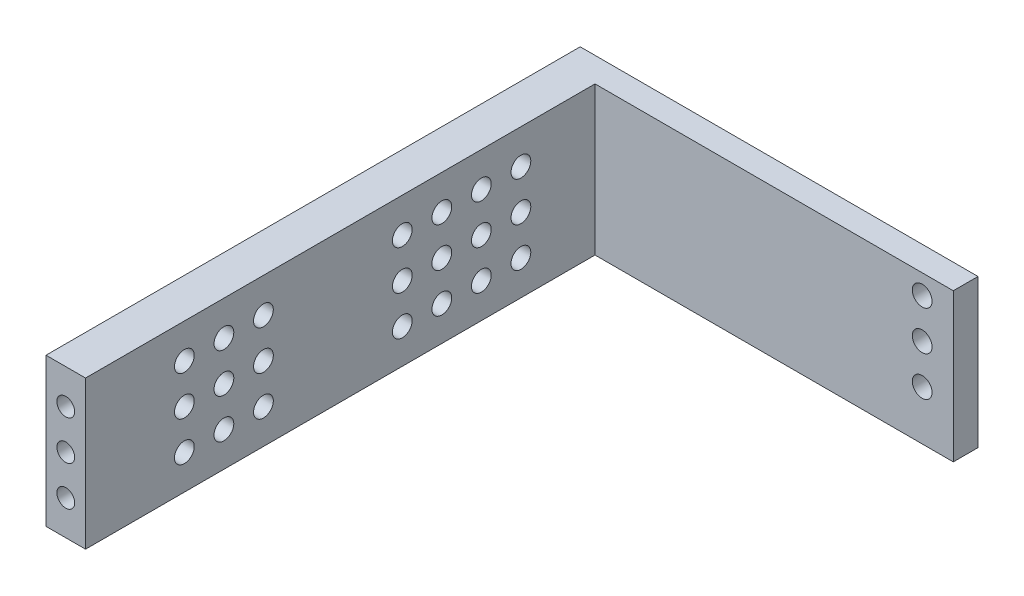
from build123d import *

# Parameters (mm, degrees)
EXTRUDE_1_DEPTH     = 30
SKETCH_3_R          = 2
CUT_EXTRUDE_2_DEPTH = 10
SKETCH_4_R          = 2
CUT_EXTRUDE_3_DEPTH = 10
SKETCH_2_R          = 1.8
CUT_EXTRUDE_4_DEPTH = 9


with BuildPart() as part:
    # 草圖1 → 填料-伸長1 (new body)
    with BuildSketch(Plane(origin=(0, 0, 0), x_dir=(1, 0, 0), z_dir=(0, 1, 0))):
        Polygon((0, 0), (0, 108.1), (80.5, 108.1), (80.5, 103.1), (8, 103.1), (8, 0), align=None)
    extrude(amount=EXTRUDE_1_DEPTH)

    # 草圖3 → 除料-伸長2 (cut)
    with BuildSketch(Plane.ZY):
        with Locations((-20, 23)):
            Circle(SKETCH_3_R)
        with Locations((-20, 15)):
            Circle(SKETCH_3_R)
        with Locations((-20, 7)):
            Circle(SKETCH_3_R)
        with Locations((-28, 23)):
            Circle(SKETCH_3_R)
        with Locations((-28, 15)):
            Circle(SKETCH_3_R)
        with Locations((-28, 7)):
            Circle(SKETCH_3_R)
        with Locations((-36, 23)):
            Circle(SKETCH_3_R)
        with Locations((-36, 15)):
            Circle(SKETCH_3_R)
        with Locations((-36, 7)):
            Circle(SKETCH_3_R)
        with Locations((-64.1, 23)):
            Circle(SKETCH_3_R)
        with Locations((-64.1, 15)):
            Circle(SKETCH_3_R)
        with Locations((-64.1, 7)):
            Circle(SKETCH_3_R)
        with Locations((-72.1, 23)):
            Circle(SKETCH_3_R)
        with Locations((-72.1, 15)):
            Circle(SKETCH_3_R)
        with Locations((-72.1, 7)):
            Circle(SKETCH_3_R)
        with Locations((-80.1, 23)):
            Circle(SKETCH_3_R)
        with Locations((-80.1, 15)):
            Circle(SKETCH_3_R)
        with Locations((-80.1, 7)):
            Circle(SKETCH_3_R)
        with Locations((-88.1, 23)):
            Circle(SKETCH_3_R)
        with Locations((-88.1, 15)):
            Circle(SKETCH_3_R)
        with Locations((-88.1, 7)):
            Circle(SKETCH_3_R)
    extrude(amount=-CUT_EXTRUDE_2_DEPTH, mode=Mode.SUBTRACT)

    # 草圖4 → 除料-伸長3 (cut)
    with BuildSketch(Plane(origin=(0, 0, -108.1), x_dir=(-1, 0, 0), z_dir=(0, 0, -1))):
        with Locations((-74.2, 26)):
            Circle(SKETCH_4_R)
        with Locations((-74.2, 18)):
            Circle(SKETCH_4_R)
        with Locations((-74.2, 10)):
            Circle(SKETCH_4_R)
    extrude(amount=-CUT_EXTRUDE_3_DEPTH, mode=Mode.SUBTRACT)

    # 草圖2 → 除料-伸長4 (cut)
    with BuildSketch(Plane.XY):
        with Locations((4, 23)):
            Circle(SKETCH_2_R)
        with Locations((4, 7)):
            Circle(SKETCH_2_R)
        with Locations((4, 15)):
            Circle(SKETCH_2_R)
    extrude(amount=-CUT_EXTRUDE_4_DEPTH, mode=Mode.SUBTRACT)


solid = part.part
